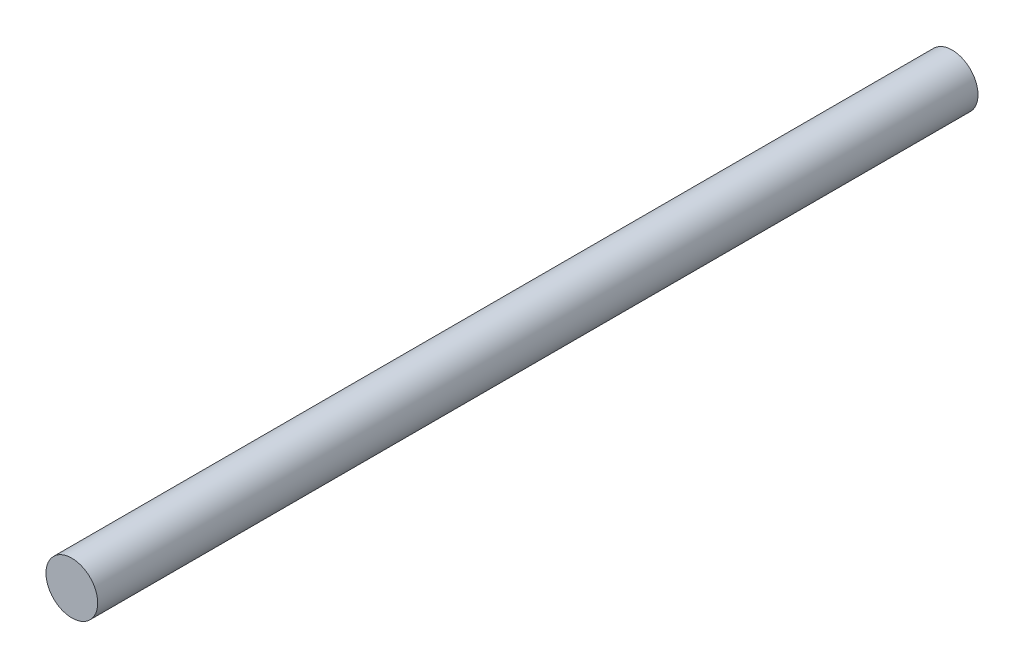
from build123d import *

# Parameters (mm, degrees)
SKETCH1_R           = 2.5
BOSS_EXTRUDE1_DEPTH = 42.5


with BuildPart() as part:
    # Sketch1 → Boss-Extrude1 (new, symmetric)
    with BuildSketch(Plane.XY):
        Circle(SKETCH1_R)
    extrude(amount=BOSS_EXTRUDE1_DEPTH, both=True)


solid = part.part
